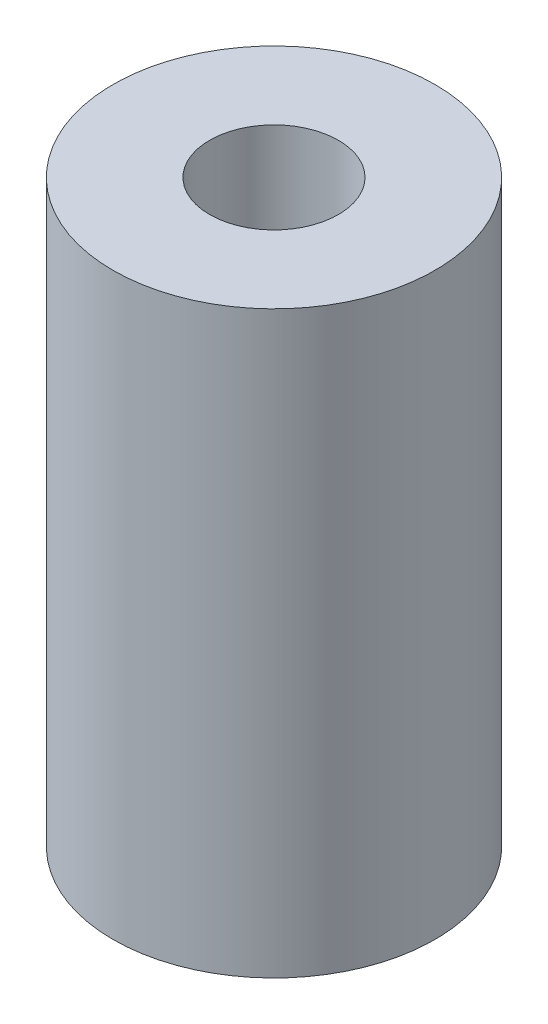
from build123d import *

# Parameters (mm, degrees)
SKETCH1_R           = 2.5
BOSS_EXTRUDE1_DEPTH = 9
SKETCH2_R           = 1
CUT_EXTRUDE1_DEPTH  = 10.669539803


with BuildPart() as part:
    # Sketch1 → Boss-Extrude1 (new body)
    with BuildSketch(Plane(origin=(0, 0, 0), x_dir=(1, 0, 0), z_dir=(0, 1, 0))):
        with Locations(Location((0, 0, 0), (0, 0, 270))):
            Circle(SKETCH1_R)
    extrude(amount=BOSS_EXTRUDE1_DEPTH)

    # Sketch2 → Cut-Extrude1 (cut, through all)
    with BuildSketch(Plane(origin=(0, 9, 0), x_dir=(1, 0, 0), z_dir=(0, 1, 0))):
        with Locations(Location((0, 0, 0), (0, 0, 270))):
            Circle(SKETCH2_R)
    extrude(amount=-CUT_EXTRUDE1_DEPTH, mode=Mode.SUBTRACT)


solid = part.part
